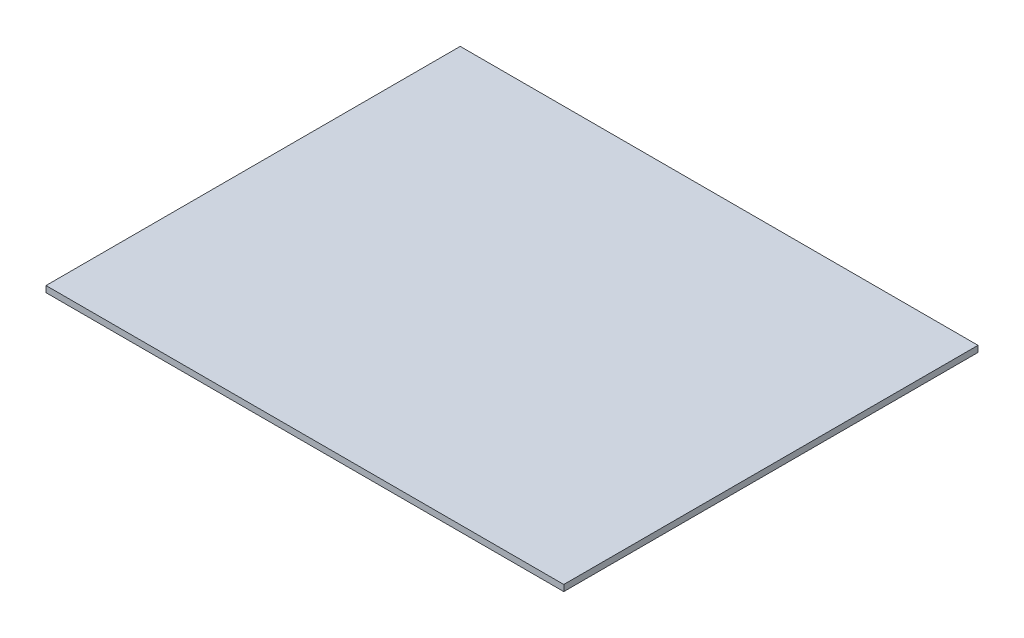
from build123d import *

# Parameters (mm, degrees)
SKETCH1_W           = 1000
SKETCH1_H           = 800
BOSS_EXTRUDE1_DEPTH = 12


with BuildPart() as part:
    # Sketch1 → Boss-Extrude1 (new body)
    with BuildSketch(Plane(origin=(0, 0, 0), x_dir=(1, 0, 0), z_dir=(0, 1, 0))):
        Rectangle(SKETCH1_W, SKETCH1_H)
    extrude(amount=BOSS_EXTRUDE1_DEPTH)


solid = part.part
